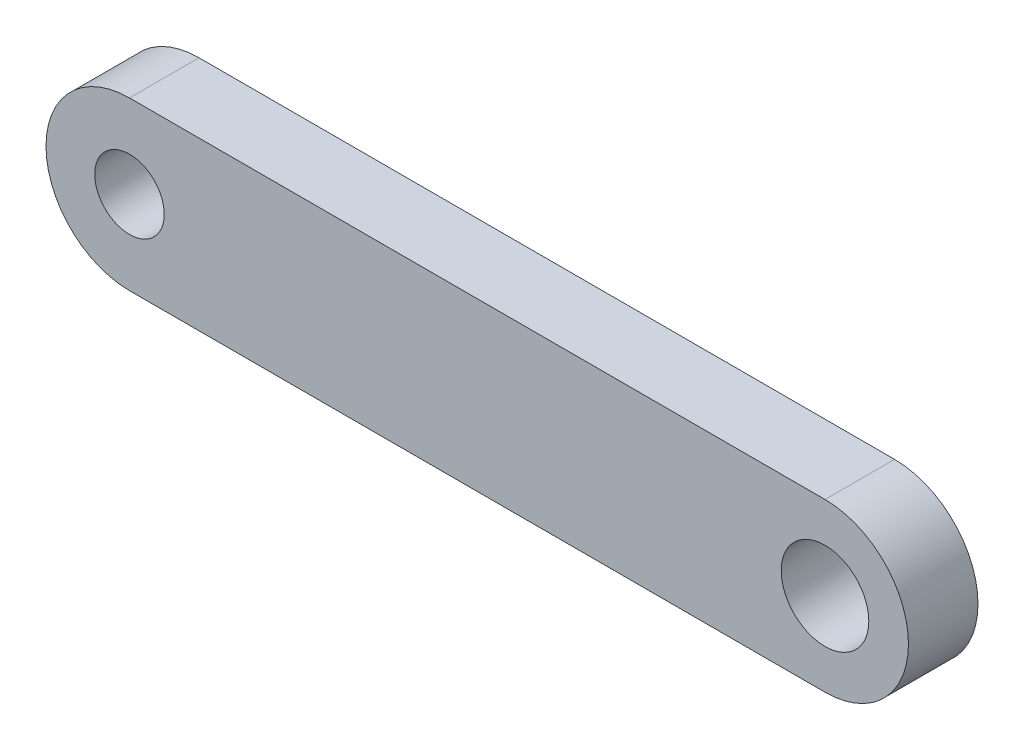
from build123d import *

# Parameters (mm, degrees)
SKETCH1_R           = 2.5
SKETCH1_R_2         = 3.15
BOSS_EXTRUDE1_DEPTH = 5


with BuildPart() as part:
    # Sketch1 → Boss-Extrude1 (new body)
    with BuildSketch(Plane.XY):
        with BuildLine():
            Line((0, 0), (50, 0))
            ThreePointArc((50, 0), (56, 6), (50, 12))
            Line((50, 12), (0, 12))
            ThreePointArc((0, 12), (-6, 6), (0, 0))
        make_face()
        with Locations((0, 6)):
            Circle(SKETCH1_R, mode=Mode.SUBTRACT)
        with Locations((50, 6)):
            Circle(SKETCH1_R_2, mode=Mode.SUBTRACT)
    extrude(amount=BOSS_EXTRUDE1_DEPTH)


solid = part.part
